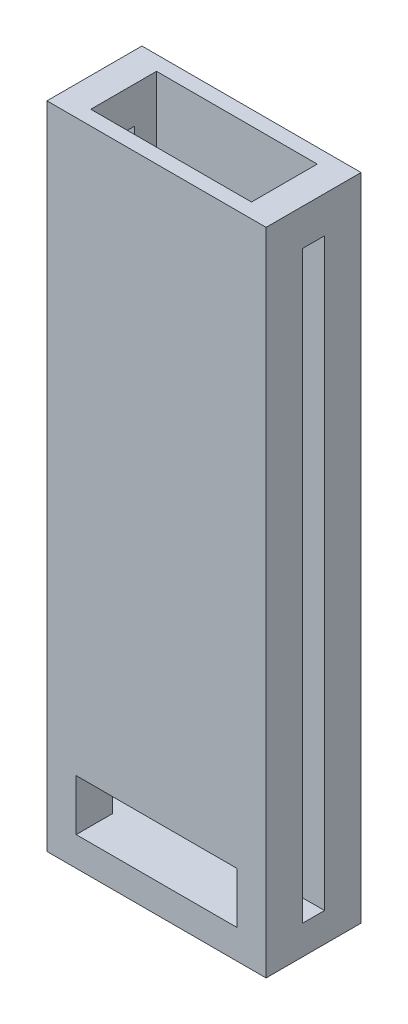
from build123d import *

# Parameters (mm, degrees)
SKETCH1_W           = 30
SKETCH1_H           = 13
BOSS_EXTRUDE1_DEPTH = 85
SKETCH2_W           = 22
SKETCH2_H           = 9
CUT_EXTRUDE2_DEPTH  = 85
SKETCH5_W           = 30
SKETCH5_H           = 13
BOSS_EXTRUDE3_DEPTH = 4
SKETCH12_W          = 22
SKETCH12_H          = 7
CUT_EXTRUDE4_DEPTH  = 13
SKETCH13_W          = 3
SKETCH13_H          = 80
CUT_EXTRUDE5_DEPTH  = 92.07140056


with BuildPart() as part:
    # Sketch1 → Boss-Extrude1 (new body)
    with BuildSketch(Plane(origin=(0, 0, 0), x_dir=(1, 0, 0), z_dir=(0, 1, 0))):
        with Locations((15, -6.5)):
            Rectangle(SKETCH1_W, SKETCH1_H)
    extrude(amount=BOSS_EXTRUDE1_DEPTH)

    # Sketch2 → Cut-Extrude2 (cut)
    with BuildSketch(Plane(origin=(0, 85, 0), x_dir=(1, 0, 0), z_dir=(0, 1, 0))):
        with Locations((15, -6.5)):
            Rectangle(SKETCH2_W, SKETCH2_H)
    extrude(amount=-CUT_EXTRUDE2_DEPTH, mode=Mode.SUBTRACT)

    # Sketch5 → Boss-Extrude3 (add)
    with BuildSketch(Plane(origin=(0, 0, 0), x_dir=(1, 0, 0), z_dir=(0, 1, 0))):
        with Locations((15, -6.5)):
            Rectangle(SKETCH5_W, SKETCH5_H)
    extrude(amount=-BOSS_EXTRUDE3_DEPTH)

    # Sketch12 → Cut-Extrude4 (cut)
    with BuildSketch(Plane.XY.offset(13)):
        with Locations((15, 3.5)):
            Rectangle(SKETCH12_W, SKETCH12_H)
    extrude(amount=-CUT_EXTRUDE4_DEPTH, mode=Mode.SUBTRACT)

    # Sketch13 → Cut-Extrude5 (cut, through all)
    with BuildSketch(Plane.ZY):
        with Locations((6.5, 40)):
            Rectangle(SKETCH13_W, SKETCH13_H)
    extrude(amount=-CUT_EXTRUDE5_DEPTH, mode=Mode.SUBTRACT)


solid = part.part
